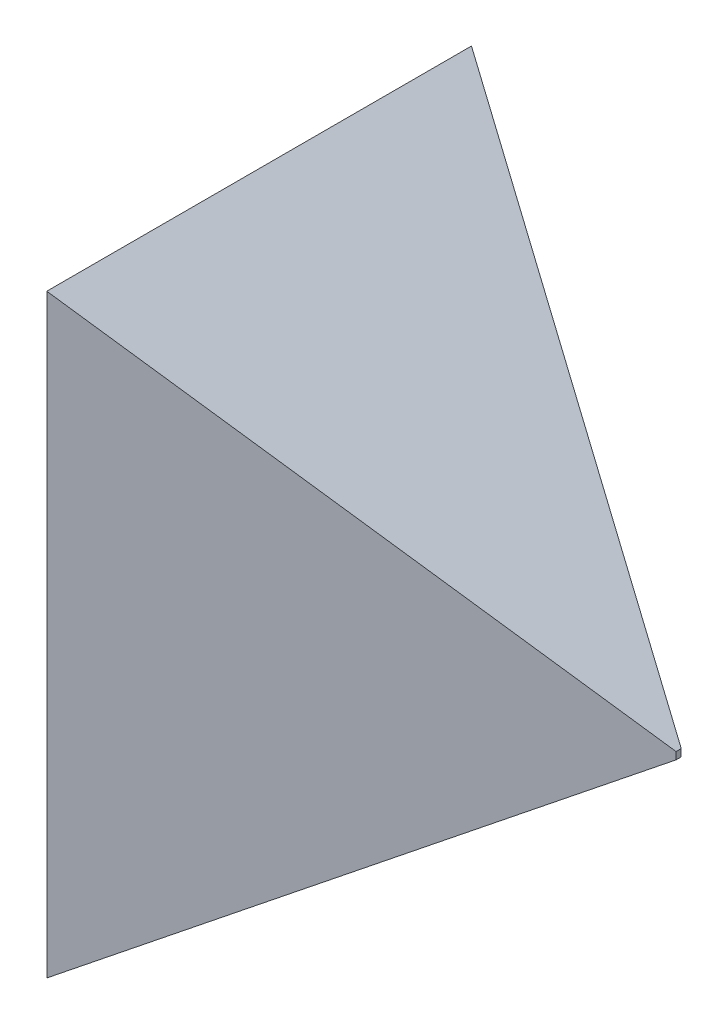
from build123d import *

# Parameters (mm, degrees)
BOSS_EXTRUDE1_DEPTH     = 20000
CUT_EXTRUDE1_DEPTH      = 30523.057128163
CUT_EXTRUDE1_DEPTH_BACK = 30523.057128163
CUT_EXTRUDE2_DEPTH      = 30523.057128163
CUT_EXTRUDE2_DEPTH_BACK = 30523.057128163
CUT_EXTRUDE3_DEPTH      = 30523.057128163
CUT_EXTRUDE3_DEPTH_BACK = 30523.057128163
CUT_EXTRUDE4_DEPTH      = 30523.057128163
CUT_EXTRUDE4_DEPTH_BACK = 30523.057128163


with BuildPart() as part:
    # Sketch3 → Boss-Extrude1 (new body)
    with BuildSketch(Plane.XY):
        with BuildLine():
            Line((0, 0), (-16383.04088578, 11471.528727021))
            ThreePointArc((-16383.04088578, 11471.528727021), (-20000, 0), (-16383.04088578, -11471.528727021))
            Line((-16383.04088578, -11471.528727021), (0, 0))
        make_face()
    extrude(amount=BOSS_EXTRUDE1_DEPTH)

    # Sketch20 → Cut-Extrude1 (cut, two sides: drawn at the far end of the back side and taken through both)
    with BuildSketch(Plane(origin=(0, 0, 0), x_dir=(1, 0, 0), z_dir=(0, 1, 0)).offset(-CUT_EXTRUDE1_DEPTH_BACK)):
        Polygon((0, -10000), (-20000, -20000), (0, -20000), align=None)
    extrude(amount=CUT_EXTRUDE1_DEPTH + CUT_EXTRUDE1_DEPTH_BACK, mode=Mode.SUBTRACT)

    # Sketch22 → Cut-Extrude2 (cut, two sides: drawn at the far end of the back side and taken through both)
    with BuildSketch(Plane(origin=(0, 0, 0), x_dir=(1, 0, 0), z_dir=(0, 1, 0)).offset(-CUT_EXTRUDE2_DEPTH_BACK)):
        Polygon((0, -10000), (-20000, 0), (0, 0), align=None)
    extrude(amount=CUT_EXTRUDE2_DEPTH + CUT_EXTRUDE2_DEPTH_BACK, mode=Mode.SUBTRACT)

    # Sketch23 → Cut-Extrude3 (cut, two sides: drawn at the far end of the back side and taken through both)
    with BuildSketch(Plane(origin=(0, 0, 0), x_dir=(1, 0, 0), z_dir=(0, 1, 0)).offset(-CUT_EXTRUDE3_DEPTH_BACK)):
        Polygon((-200, -10100), (-200, -9900), (0, -10000), align=None)
    extrude(amount=CUT_EXTRUDE3_DEPTH + CUT_EXTRUDE3_DEPTH_BACK, mode=Mode.SUBTRACT)

    # Sketch24 → Cut-Extrude4 (cut, two sides: drawn at the far end of the back side and taken through both)
    with BuildSketch(Plane(origin=(0, 0, 0), x_dir=(1, 0, 0), z_dir=(0, 1, 0)).offset(-CUT_EXTRUDE4_DEPTH_BACK)):
        Polygon((-16383.04088578, -18191.52044289), (-16383.04088578, -1808.47955711), (-20000, 0), (-20000, -20000), align=None)
    extrude(amount=CUT_EXTRUDE4_DEPTH + CUT_EXTRUDE4_DEPTH_BACK, mode=Mode.SUBTRACT)


solid = part.part
